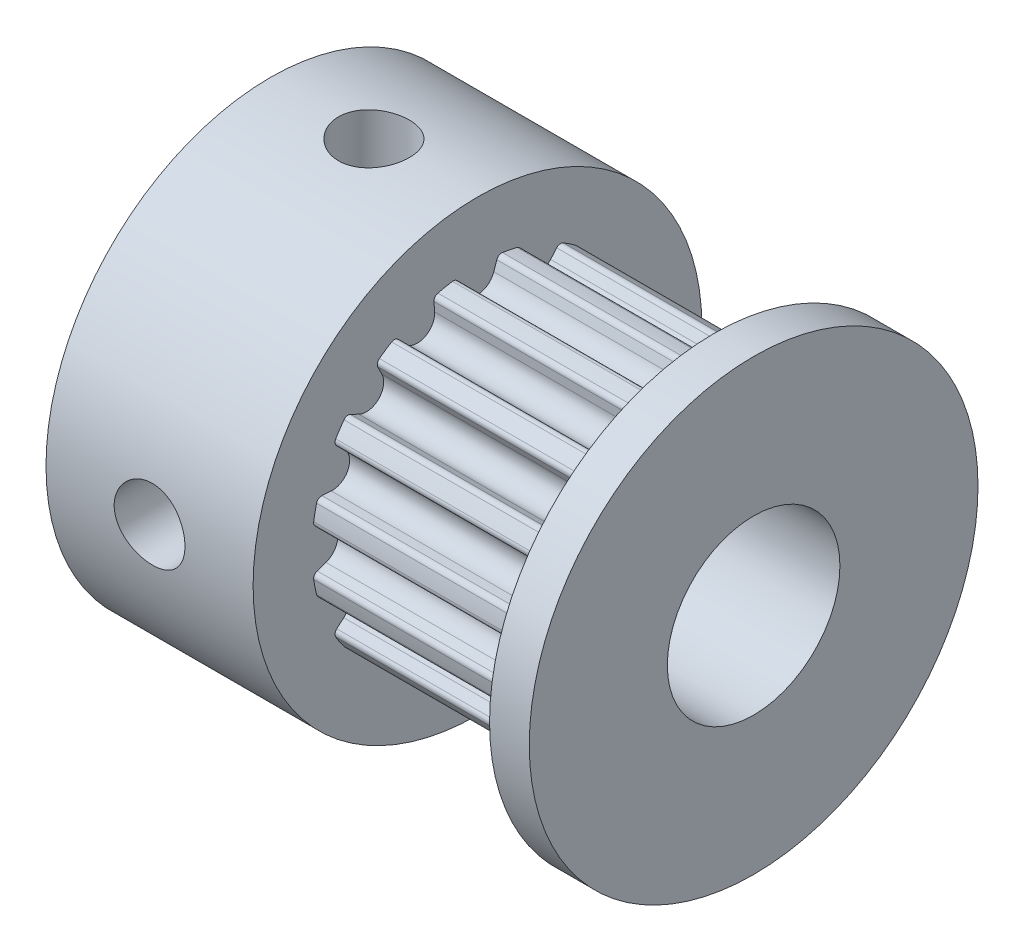
from build123d import *

# Parameters (mm, degrees)
CROQUIS1_R                               = 6.5
CORPO_LADO_MOTOR_13X6_DEPTH              = 6
CROQUIS3_R                               = 4.8
CORPO_DOS_DENTES_9_6X6_85_DEPTH          = 6.85
CORTE_DO_DENTE_R0_5_REACH                = 13.464
ARREDONDAMENTO_RAIO_0_15MM_R             = 0.15
CORTE_DOS_16_DENTES_COUNT                = 16
ARREDONDAMENTO_RAIO_0_15MM_OF_CORTE_DO_R = 0.15
CROQUIS4_R                               = 6.5
FACE_DIREITA_20_DEPTH                    = 1.15
CROQUIS6_R                               = 2.5
FURO_PASSANTE_5_DEPTH                    = 14
FURO_DE_FIXA_O_1_M2_5_REACH              = 22.18
FURO_DE_FIXA_O_1_M2_5_BORE_R             = 1.025
FURO_DE_FIXA_O_2_M2_5_COUNT              = 2
FURO_DE_FIXA_O_2_M2_5_ANGLE              = 90


with BuildPart() as part:
    # Croquis1 → Corpo Lado Motor - Ø13x6 (new body)
    with BuildSketch(Plane(origin=(0, 0, 0), x_dir=(0, 0, -1), z_dir=(1, 0, 0))):
        Circle(CROQUIS1_R)
    extrude(amount=CORPO_LADO_MOTOR_13X6_DEPTH)

    # Croquis3 → Corpo dos Dentes Ø9.6x6.85 (add)
    with BuildSketch(Plane(origin=(6, 0, 0), x_dir=(0, 0, -1), z_dir=(1, 0, 0))):
        with Locations(Location((0, 0, 0), (0, 0, 180))):
            Circle(CROQUIS3_R)
    extrude(amount=CORPO_DOS_DENTES_9_6X6_85_DEPTH)

    # Croquis5 → Corte do Dente - R0.5 (cut, up to next)
    with BuildSketch(Plane(origin=(6, 0, 0), x_dir=(0, 0, -1), z_dir=(1, 0, 0)), mode=Mode.PRIVATE) as corte_do_dente_r0_5_sk1:
        with BuildLine():
            Line((-0.473505997, 4.389400899), (-0.6, 4.76235236))
            ThreePointArc((-0.6, 4.76235236), (0, 4.8), (0.6, 4.76235236))
            Line((0.6, 4.76235236), (0.473505997, 4.389400899))
            ThreePointArc((0.473505997, 4.389400899), (0, 4.05), (-0.473505997, 4.389400899))
        make_face()
    corte_do_dente_r0_5_tool1 = extrude(corte_do_dente_r0_5_sk1.sketch, amount=CORTE_DO_DENTE_R0_5_REACH, mode=Mode.PRIVATE) & part.part
    corte_do_dente_r0_5 = corte_do_dente_r0_5_tool1.solids().sort_by_distance((6, 4.473914, 0))[0]
    add(corte_do_dente_r0_5, mode=Mode.SUBTRACT)

    # Arredondamento - Raio 0.15mm
    arredondamento_raio_0_15mm_edges = [part.edges().sort_by_distance(p)[0] for p in [
        (9.425, 4.76235236, 0.6),
        (9.425, 4.76235236, -0.6),
    ]]
    fillet(arredondamento_raio_0_15mm_edges, radius=ARREDONDAMENTO_RAIO_0_15MM_R)

    # Corte dos 16 Dentes: Corte do Dente - R0.5 ×16 about axis
    corte_dos_16_dentes_axis = Axis((0, 0, 0), (1, 0, 0))
    for i in range(1, CORTE_DOS_16_DENTES_COUNT):
        add(corte_do_dente_r0_5.rotate(corte_dos_16_dentes_axis, i * 360 / CORTE_DOS_16_DENTES_COUNT), mode=Mode.SUBTRACT)

    # Arredondamento - Raio 0.15mm of Corte do
    arredondamento_raio_0_15mm_of_corte_do_edges = [part.edges().sort_by_distance(p)[0] for p in [
        (9.425, 4.170229813, 2.376801067),
        (9.425, 4.629449931, 1.268145628),
        (9.425, 2.943227579, 3.791755717),
        (9.425, 3.791755717, 2.943227579),
        (9.425, 1.268145628, 4.629449931),
        (9.425, 2.376801067, 4.170229813),
        (9.425, -0.6, 4.76235236),
        (9.425, 0.6, 4.76235236),
        (9.425, -2.376801067, 4.170229813),
        (9.425, -1.268145628, 4.629449931),
        (9.425, -3.791755717, 2.943227579),
        (9.425, -2.943227579, 3.791755717),
        (9.425, -4.629449931, 1.268145628),
        (9.425, -4.170229813, 2.376801067),
        (9.425, -4.76235236, -0.6),
        (9.425, -4.76235236, 0.6),
        (9.425, -4.170229813, -2.376801067),
        (9.425, -4.629449931, -1.268145628),
        (9.425, -2.943227579, -3.791755717),
        (9.425, -3.791755717, -2.943227579),
        (9.425, -1.268145628, -4.629449931),
        (9.425, -2.376801067, -4.170229813),
        (9.425, 0.6, -4.76235236),
        (9.425, -0.6, -4.76235236),
        (9.425, 2.376801067, -4.170229813),
        (9.425, 1.268145628, -4.629449931),
        (9.425, 3.791755717, -2.943227579),
        (9.425, 2.943227579, -3.791755717),
        (9.425, 4.629449931, -1.268145628),
        (9.425, 4.170229813, -2.376801067),
    ]]
    fillet(arredondamento_raio_0_15mm_of_corte_do_edges, radius=ARREDONDAMENTO_RAIO_0_15MM_OF_CORTE_DO_R)

    # Croquis4 → Face Direita Ø20 (add)
    with BuildSketch(Plane(origin=(12.85, 0, 0), x_dir=(0, 0, -1), z_dir=(1, 0, 0))):
        Circle(CROQUIS4_R)
    extrude(amount=FACE_DIREITA_20_DEPTH)

    # Croquis6 → Furo Passante Ø5 (cut)
    with BuildSketch(Plane.ZY):
        Circle(CROQUIS6_R)
    extrude(amount=-FURO_PASSANTE_5_DEPTH, mode=Mode.SUBTRACT)

    # Furo de Fixação 1 - M2.5 bore → Furo de Fixação 1 - M2.5 (cut, up to next)
    with BuildSketch(Plane(origin=(0, 6.5, 0), x_dir=(1, 0, 0), z_dir=(0, 1, 0)), mode=Mode.PRIVATE) as furo_de_fixa_o_1_m2_5_sk1:
        with Locations((3, 0)):
            Circle(FURO_DE_FIXA_O_1_M2_5_BORE_R)
    furo_de_fixa_o_1_m2_5_tool1 = extrude(furo_de_fixa_o_1_m2_5_sk1.sketch, amount=-FURO_DE_FIXA_O_1_M2_5_REACH, mode=Mode.PRIVATE) & part.part
    furo_de_fixa_o_1_m2_5 = furo_de_fixa_o_1_m2_5_tool1.solids().sort_by_distance((3, 6.5, 0))[0]
    add(furo_de_fixa_o_1_m2_5, mode=Mode.SUBTRACT)

    # Furo de Fixação 2 - M2.5: Furo de Fixação 1 - M2.5 ×2 about axis
    furo_de_fixa_o_2_m2_5_axis = Axis((21.071067812, 0, 0), (1, 0, 0))
    for i in range(1, FURO_DE_FIXA_O_2_M2_5_COUNT):
        add(furo_de_fixa_o_1_m2_5.rotate(furo_de_fixa_o_2_m2_5_axis, i * FURO_DE_FIXA_O_2_M2_5_ANGLE / (FURO_DE_FIXA_O_2_M2_5_COUNT - 1)), mode=Mode.SUBTRACT)


solid = part.part
